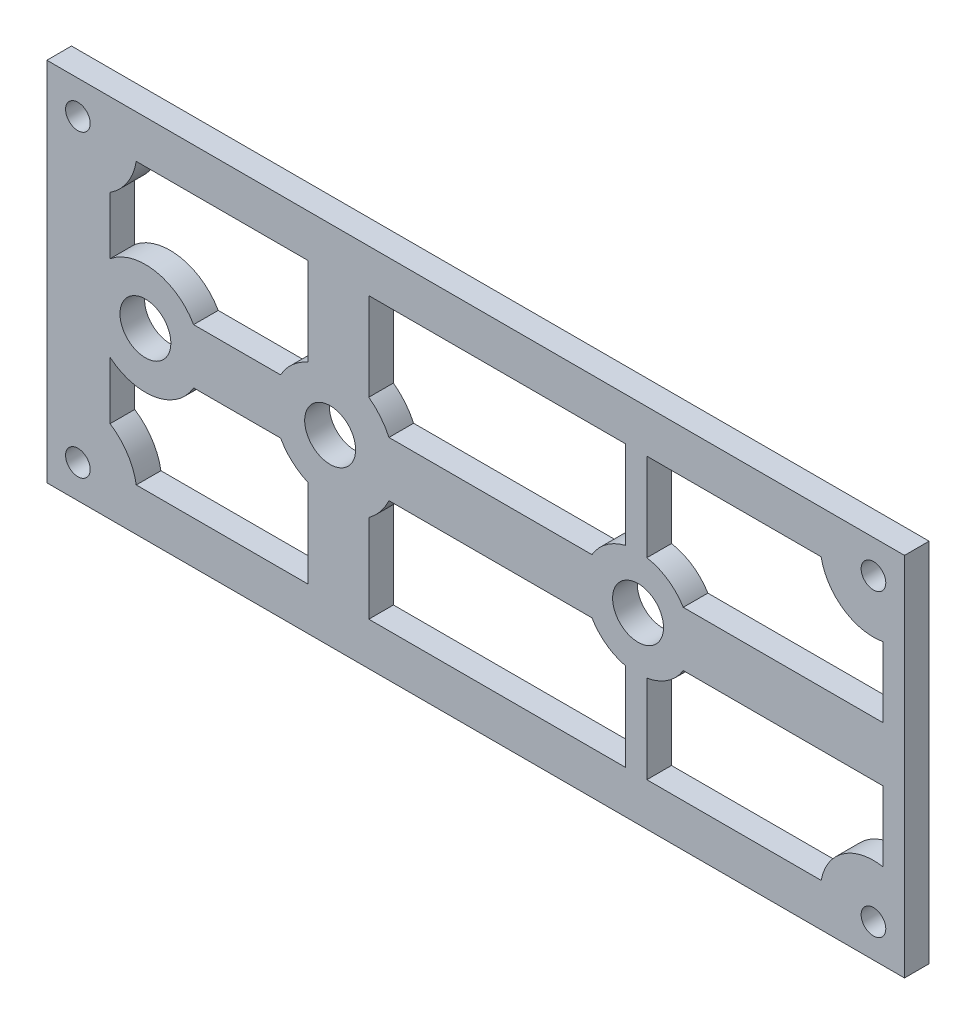
from build123d import *

# Parameters (mm, degrees)
SKETCH1_W               = 104.449895642
SKETCH1_H               = 44.57694291
BOSS_EXTRUDE1_DEPTH     = 3
SKETCH3_R               = 3.1
CUT_EXTRUDE1_DEPTH      = 10
SKETCH4_R               = 1.5
CUT_EXTRUDE2_DEPTH      = 10
MIRROR2_COPY_1_SKETCH_R = 1.5
MIRROR2_COPY_1_DEPTH    = 10
CUT_EXTRUDE3_DEPTH      = 57.861420442
CUT_EXTRUDE4_DEPTH      = 57.861420442
CUT_EXTRUDE5_DEPTH      = 57.861420442


with BuildPart() as part:
    # Sketch1 → Boss-Extrude1 (new body)
    with BuildSketch(Plane.XY):
        Rectangle(SKETCH1_W, SKETCH1_H)
    extrude(amount=BOSS_EXTRUDE1_DEPTH)

    # Sketch3 → Cut-Extrude1 (cut)
    with BuildSketch(Plane.XY.offset(3)):
        with Locations((19.775052179, 0)):
            Circle(SKETCH3_R)
        with Locations((-17.724947821, 0)):
            Circle(SKETCH3_R)
        with Locations((-40.224947821, 0)):
            Circle(SKETCH3_R)
    extrude(amount=-CUT_EXTRUDE1_DEPTH, mode=Mode.SUBTRACT)

    # Sketch4 → Cut-Extrude2 (cut)
    with BuildSketch(Plane.XY.offset(3)):
        with Locations((-48.447057672, 18.248177723)):
            Circle(SKETCH4_R)
    cut_extrude2 = extrude(amount=-CUT_EXTRUDE2_DEPTH, mode=Mode.SUBTRACT)

    # Mirror1: Cut-Extrude2 across plane
    add(cut_extrude2.mirror(Plane(origin=(0, 0, 0), x_dir=(0, 0, 1), z_dir=(1, 0, 0))), mode=Mode.SUBTRACT)

    # Mirror2: Cut-Extrude2 across plane
    add(cut_extrude2.mirror(Plane.ZX), mode=Mode.SUBTRACT)

    # Mirror2 copy 1 sketch → Mirror2 copy 1 (cut)
    with BuildSketch(Plane(origin=(0, 0, 3), x_dir=(-1, 0, 0), z_dir=(0, 0, 1))):
        with Locations((-48.447057672, 18.248177723)):
            Circle(MIRROR2_COPY_1_SKETCH_R)
    extrude(amount=-MIRROR2_COPY_1_DEPTH, mode=Mode.SUBTRACT)

    # Sketch5 → Cut-Extrude3 (cut, through all)
    with BuildSketch(Plane.XY.offset(3)):
        with BuildLine():
            Line((-41.337055779, 17.064455462), (-20.413840907, 17.064455462))
            Line((-20.413840907, 17.064455462), (-20.413840907, 6.345404524))
            ThreePointArc((-20.413840907, 6.345404524), (-22.338128988, 5.11985001), (-23.756861687, 3.333214622))
            Line((-23.756861687, 3.333214622), (-34.356294023, 3.333214622))
            ThreePointArc((-34.356294023, 3.333214622), (-39.005765332, 6.638148173), (-44.52617342, 5.201045612))
            Line((-44.52617342, 5.201045612), (-44.52617342, 12.200038175))
            ThreePointArc((-44.52617342, 12.200038175), (-42.419143342, 14.296270065), (-41.337055779, 17.064455462))
        make_face()
    cut_extrude3 = extrude(amount=-CUT_EXTRUDE3_DEPTH, mode=Mode.SUBTRACT)

    # Mirror3: Cut-Extrude3 across plane
    add(cut_extrude3.mirror(Plane.ZX), mode=Mode.SUBTRACT)

    # Sketch6 → Cut-Extrude4 (cut, through all)
    with BuildSketch(Plane.XY.offset(3)):
        with BuildLine():
            Line((-13.015804561, -17.064455462), (-13.015804561, -6.345404524))
            ThreePointArc((-13.015804561, -6.345404524), (-11.600072812, -4.992604025), (-10.56046116, -3.333214622))
            Line((-10.56046116, -3.333214622), (14.157752022, -3.333214622))
            ThreePointArc((14.157752022, -3.333214622), (15.888120713, -5.249394684), (18.225787128, -6.345404524))
            Line((18.225787128, -6.345404524), (18.225787128, -17.064455462))
            Line((18.225787128, -17.064455462), (-13.015804561, -17.064455462))
        make_face()
    cut_extrude4 = extrude(amount=-CUT_EXTRUDE4_DEPTH, mode=Mode.SUBTRACT)

    # Mirror4: Cut-Extrude4 across plane
    add(cut_extrude4.mirror(Plane.ZX), mode=Mode.SUBTRACT)

    # Sketch7 → Cut-Extrude5 (cut, through all)
    with BuildSketch(Plane.XY.offset(3)):
        with BuildLine():
            Line((20.845739993, -6.345404524), (20.845739993, -17.064455462))
            Line((20.845739993, -17.064455462), (42.074566495, -17.064455462))
            ThreePointArc((42.074566495, -17.064455462), (44.778043986, -12.905127961), (49.630779933, -11.875686546))
            Line((49.630779933, -11.875686546), (49.630779933, -3.333214622))
            Line((49.630779933, -3.333214622), (25.279614946, -3.333214622))
            ThreePointArc((25.279614946, -3.333214622), (23.391238299, -5.322943633), (20.845739993, -6.345404524))
        make_face()
    cut_extrude5 = extrude(amount=-CUT_EXTRUDE5_DEPTH, mode=Mode.SUBTRACT)

    # Mirror5: Cut-Extrude5 across plane
    add(cut_extrude5.mirror(Plane.ZX), mode=Mode.SUBTRACT)


solid = part.part
